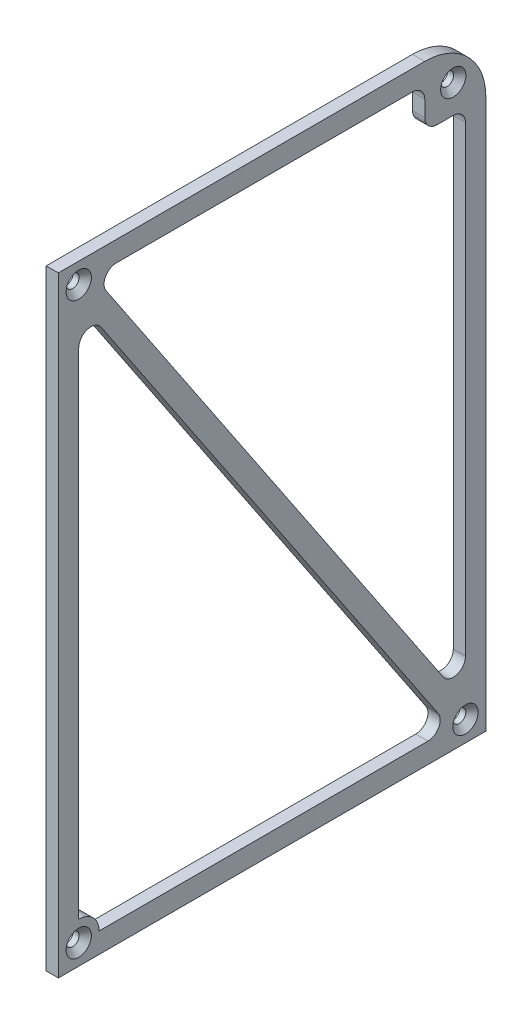
from build123d import *

# Parameters (mm, degrees)
SKETCH1_R           = 1.6
BOSS_EXTRUDE2_DEPTH = 3
FILLET1_R           = 3
CHAMFER1_SIZE       = 1.5


with BuildPart() as part:
    # Sketch1 → Boss-Extrude2 (new body)
    with BuildSketch(Plane(origin=(0, 0, 0), x_dir=(0, 0, -1), z_dir=(1, 0, 0))):
        with BuildLine():
            Line((0, 0), (105, 0))
            Line((105, 0), (105, 135))
            ThreePointArc((105, 135), (100.606601718, 145.606601718), (90, 150))
            Line((90, 150), (0, 150))
            Line((0, 150), (0, 0))
        make_face()
        with Locations((5, 145)):
            Circle(SKETCH1_R, mode=Mode.SUBTRACT)
        with Locations((97, 142)):
            Circle(SKETCH1_R, mode=Mode.SUBTRACT)
        with Locations((100, 5)):
            Circle(SKETCH1_R, mode=Mode.SUBTRACT)
        with Locations((5, 5)):
            Circle(SKETCH1_R, mode=Mode.SUBTRACT)
        Polygon((8.6, 145), (90, 145), (90, 135), (100, 135), (100, 8.6), align=None, mode=Mode.SUBTRACT)
        with BuildLine():
            Line((5, 10), (5, 141.4))
            Line((5, 141.4), (96.4, 5))
            Line((96.4, 5), (10, 5))
            ThreePointArc((10, 5), (8.535533906, 8.535533906), (5, 10))
        make_face(mode=Mode.SUBTRACT)
    extrude(amount=BOSS_EXTRUDE2_DEPTH)

    # Fillet1
    fillet1_edges = [part.edges().sort_by_distance(p)[0] for p in [
        (1.5, 5, -96.4),
        (1.5, 141.4, -5),
        (1.5, 145, -90),
        (1.5, 145, -8.6),
        (1.5, 8.6, -100),
        (1.5, 135, -100),
        (1.5, 135, -90),
    ]]
    fillet(fillet1_edges, radius=FILLET1_R)

    # Chamfer1
    chamfer1_edges = [part.edges().sort_by_distance(p)[0] for p in [
        (3, 5, -3.4),
        (3, 5, -98.4),
        (3, 142, -95.4),
        (3, 145, -3.4),
    ]]
    chamfer(chamfer1_edges, length=CHAMFER1_SIZE)


solid = part.part
